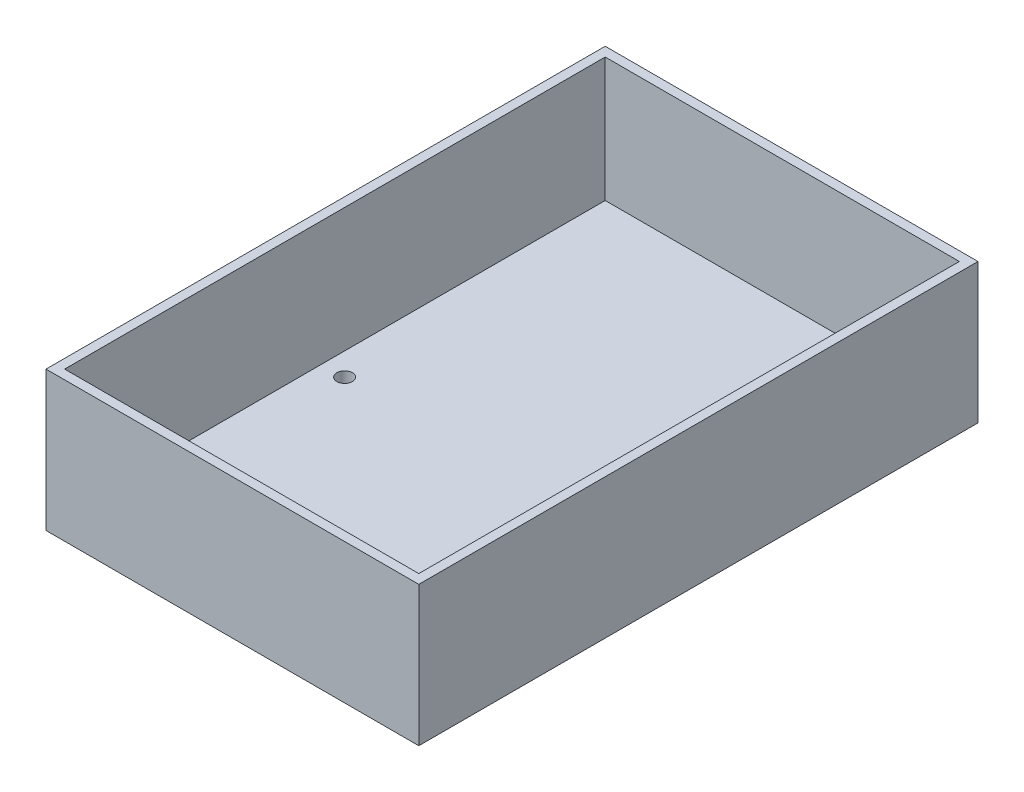
from build123d import *

# Parameters (mm, degrees)
SKETCH1_W           = 120
SKETCH1_H           = 180
BOSS_EXTRUDE1_DEPTH = 45
SKETCH3_W           = 114
SKETCH3_H           = 174
CUT_EXTRUDE1_DEPTH  = 40
SKETCH4_R           = 2.5
CUT_EXTRUDE2_DEPTH  = 5


with BuildPart() as part:
    # Sketch1 → Boss-Extrude1 (new body)
    with BuildSketch(Plane(origin=(0, 0, 0), x_dir=(1, 0, 0), z_dir=(0, 1, 0))):
        with Locations((60, 90)):
            Rectangle(SKETCH1_W, SKETCH1_H)
    extrude(amount=BOSS_EXTRUDE1_DEPTH)

    # Sketch3 → Cut-Extrude1 (cut)
    with BuildSketch(Plane(origin=(0, 45, 0), x_dir=(1, 0, 0), z_dir=(0, 1, 0))):
        with Locations((60, 90)):
            Rectangle(SKETCH3_W, SKETCH3_H)
    extrude(amount=-CUT_EXTRUDE1_DEPTH, mode=Mode.SUBTRACT)

    # Sketch4 → Cut-Extrude2 (cut)
    with BuildSketch(Plane(origin=(0, 5, 0), x_dir=(1, 0, 0), z_dir=(0, 1, 0))):
        with Locations(Location((10.3, 85.818636822, 0), (0, 0, 270))):
            Circle(SKETCH4_R)
        with Locations(Location((60, 7, 0), (0, 0, 270))):
            Circle(SKETCH4_R)
    extrude(amount=-CUT_EXTRUDE2_DEPTH, mode=Mode.SUBTRACT)


solid = part.part
